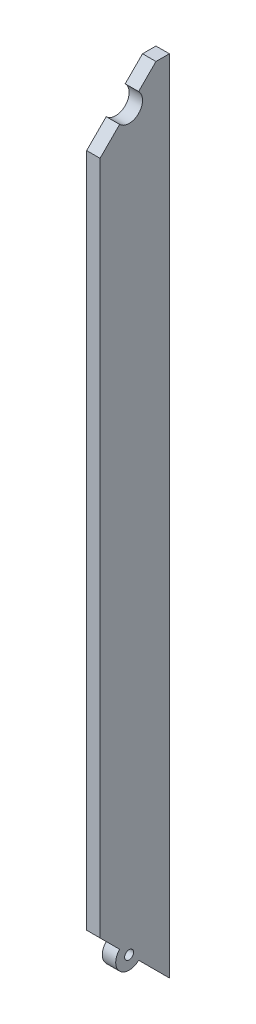
from build123d import *

# Parameters (mm, degrees)
BOSS_EXTRUDE1_DEPTH = 6
SKETCH4_R           = 6
BOSS_EXTRUDE2_DEPTH = 6
SKETCH3_R           = 6
SKETCH3_R_2         = 2
CUT_EXTRUDE1_DEPTH  = 353.937671551


with BuildPart() as part:
    # Sketch2 → Boss-Extrude1 (new body)
    with BuildSketch(Plane(origin=(0, 0, 0), x_dir=(0, 0, -1), z_dir=(1, 0, 0))):
        Polygon((6, 352), (0, 352), (-25, 327), (-25, 25), (6, -6), align=None)
    extrude(amount=BOSS_EXTRUDE1_DEPTH)

    # Sketch4 → Boss-Extrude2 (add)
    with BuildSketch(Plane(origin=(6, 0, 0), x_dir=(0, 0, -1), z_dir=(1, 0, 0))):
        with Locations((-12, 12)):
            Circle(SKETCH4_R)
    extrude(amount=-BOSS_EXTRUDE2_DEPTH)

    # Sketch3 → Cut-Extrude1 (cut, through all)
    with BuildSketch(Plane(origin=(6, 0, 0), x_dir=(0, 0, -1), z_dir=(1, 0, 0))):
        with Locations((-12, 340)):
            Circle(SKETCH3_R)
        with Locations((-12, 12)):
            Circle(SKETCH3_R_2)
    extrude(amount=-CUT_EXTRUDE1_DEPTH, mode=Mode.SUBTRACT)


solid = part.part
